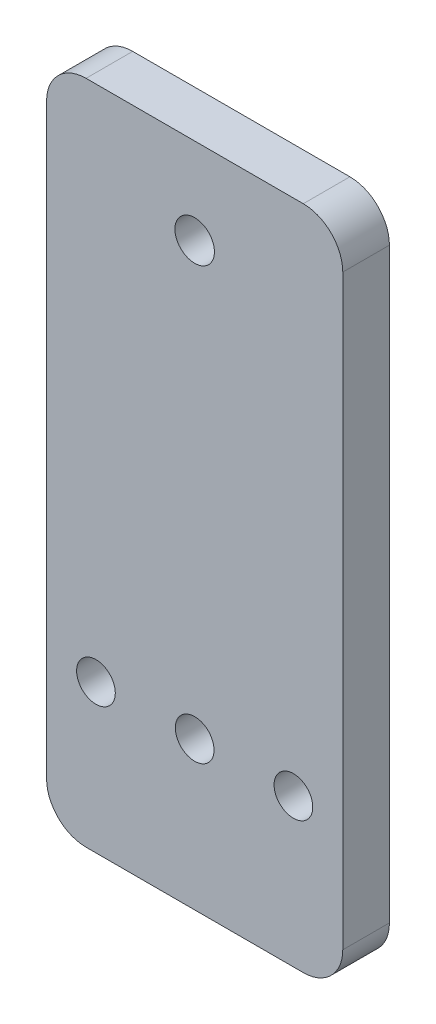
from build123d import *

# Parameters (mm, degrees)
SKETCH1_R           = 2.4892
SKETCH1_R_2         = 2.54
BOSS_EXTRUDE1_DEPTH = 6


with BuildPart() as part:
    # Sketch1 → Boss-Extrude1 (new body)
    with BuildSketch(Plane.XY):
        with BuildLine():
            Line((-382.27, -19.05), (-354.33, -19.05))
            ThreePointArc((-354.33, -19.05), (-350.737897552, -17.562102448), (-349.25, -13.97))
            Line((-349.25, -13.97), (-349.25, 61.53))
            ThreePointArc((-349.25, 61.53), (-350.737897552, 65.122102448), (-354.33, 66.61))
            Line((-354.33, 66.61), (-382.27, 66.61))
            ThreePointArc((-382.27, 66.61), (-385.862102448, 65.122102448), (-387.35, 61.53))
            Line((-387.35, 61.53), (-387.35, -13.97))
            ThreePointArc((-387.35, -13.97), (-385.862102448, -17.562102448), (-382.27, -19.05))
        make_face()
        with Locations((-368.3, 0)):
            Circle(SKETCH1_R, mode=Mode.SUBTRACT)
        with Locations((-355.6, 0)):
            Circle(SKETCH1_R, mode=Mode.SUBTRACT)
        with Locations((-381, 0)):
            Circle(SKETCH1_R, mode=Mode.SUBTRACT)
        with Locations((-368.3, 55.53)):
            Circle(SKETCH1_R_2, mode=Mode.SUBTRACT)
    extrude(amount=BOSS_EXTRUDE1_DEPTH)


solid = part.part
